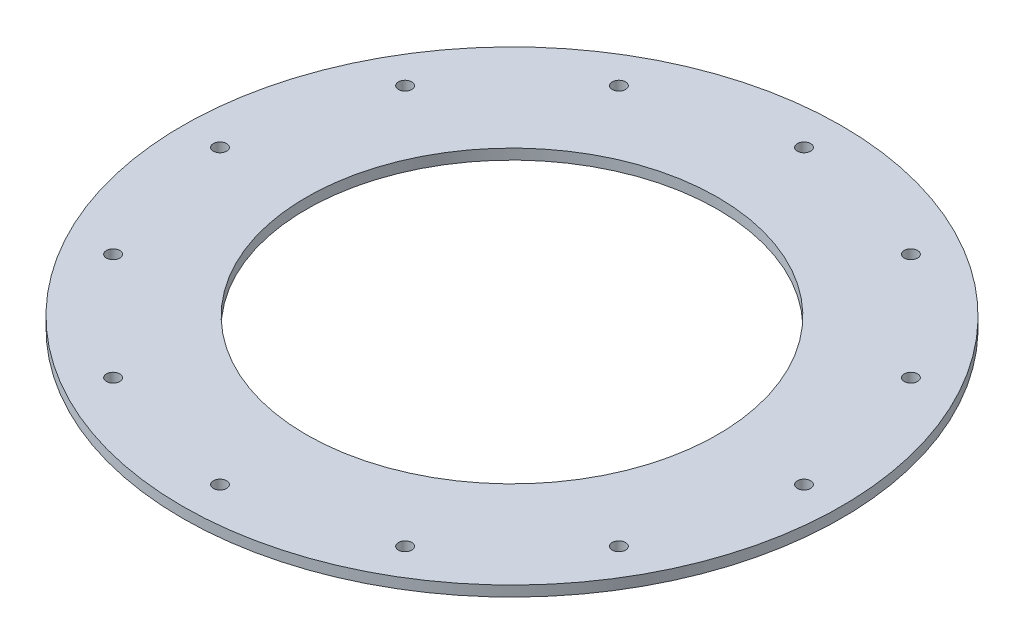
from build123d import *

# Parameters (mm, degrees)
SKETCH1_R           = 79
SKETCH1_R_2         = 49.3
BOSS_EXTRUDE1_DEPTH = 2.5
SKETCH2_R           = 1.6
CUT_EXTRUDE1_DEPTH  = 112.750838923


with BuildPart() as part:
    # Sketch1 → Boss-Extrude1 (new body)
    with BuildSketch(Plane(origin=(0, 0, 0), x_dir=(1, 0, 0), z_dir=(0, 1, 0))):
        with Locations(Location((0, 0, 0), (0, 0, 270))):
            Circle(SKETCH1_R)
        with Locations(Location((0, 0, 0), (0, 0, 270))):
            Circle(SKETCH1_R_2, mode=Mode.SUBTRACT)
    extrude(amount=BOSS_EXTRUDE1_DEPTH)

    # Sketch2 → Cut-Extrude1 (cut, through all)
    with BuildSketch(Plane(origin=(0, 2.5, 0), x_dir=(1, 0, 0), z_dir=(0, 1, 0))):
        with Locations(Location((0, 70, 0), (0, 0, 270))):
            Circle(SKETCH2_R)
        with Locations(Location((35, 60.621778265, 0), (0, 0, 270))):
            Circle(SKETCH2_R)
        with Locations(Location((60.621778265, 35, 0), (0, 0, 270))):
            Circle(SKETCH2_R)
        with Locations(Location((70, 0, 0), (0, 0, 270))):
            Circle(SKETCH2_R)
        with Locations(Location((60.621778265, -35, 0), (0, 0, 270))):
            Circle(SKETCH2_R)
        with Locations(Location((35, -60.621778265, 0), (0, 0, 270))):
            Circle(SKETCH2_R)
        with Locations(Location((0, -70, 0), (0, 0, 270))):
            Circle(SKETCH2_R)
        with Locations(Location((-35, -60.621778265, 0), (0, 0, 270))):
            Circle(SKETCH2_R)
        with Locations(Location((-60.621778265, -35, 0), (0, 0, 270))):
            Circle(SKETCH2_R)
        with Locations(Location((-70, 0, 0), (0, 0, 270))):
            Circle(SKETCH2_R)
        with Locations(Location((-60.621778265, 35, 0), (0, 0, 270))):
            Circle(SKETCH2_R)
        with Locations(Location((-35, 60.621778265, 0), (0, 0, 270))):
            Circle(SKETCH2_R)
    extrude(amount=-CUT_EXTRUDE1_DEPTH, mode=Mode.SUBTRACT)


solid = part.part
